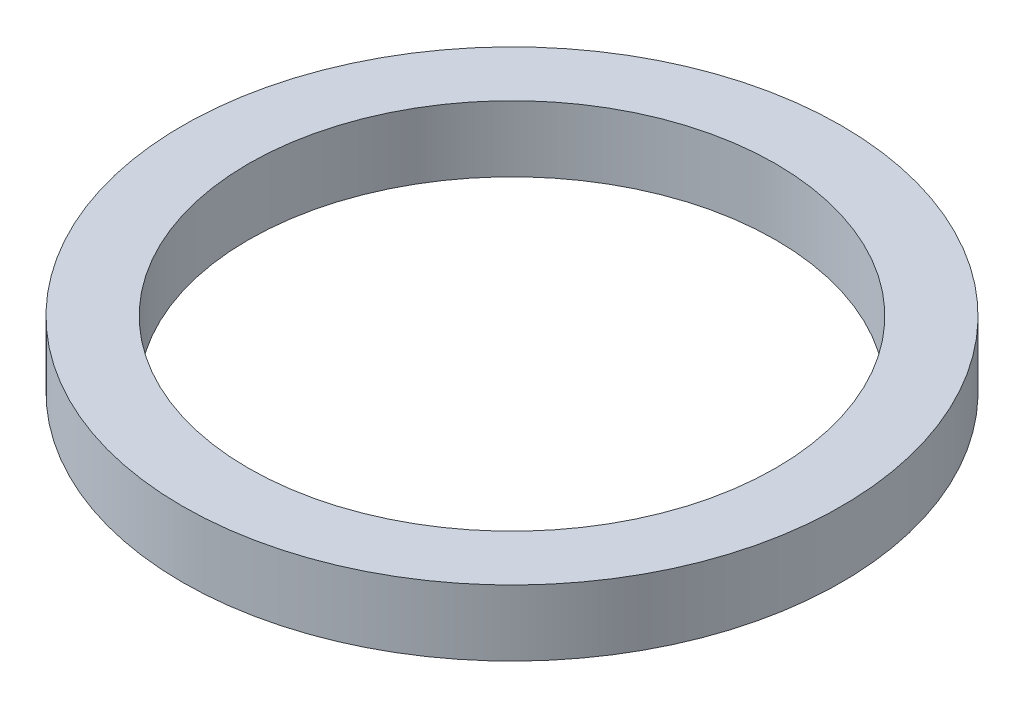
from build123d import *

# Parameters (mm, degrees)
SKETCH1_R           = 15.875
SKETCH1_R_2         = 12.7
BOSS_EXTRUDE1_DEPTH = 3.175


with BuildPart() as part:
    # Sketch1 → Boss-Extrude1 (new body)
    with BuildSketch(Plane(origin=(0, 0, 0), x_dir=(1, 0, 0), z_dir=(0, 1, 0))):
        with Locations(Location((0, 0, 0), (0, 0, 270))):
            Circle(SKETCH1_R)
        with Locations(Location((0, 0, 0), (0, 0, 270))):
            Circle(SKETCH1_R_2, mode=Mode.SUBTRACT)
    extrude(amount=BOSS_EXTRUDE1_DEPTH)


solid = part.part
